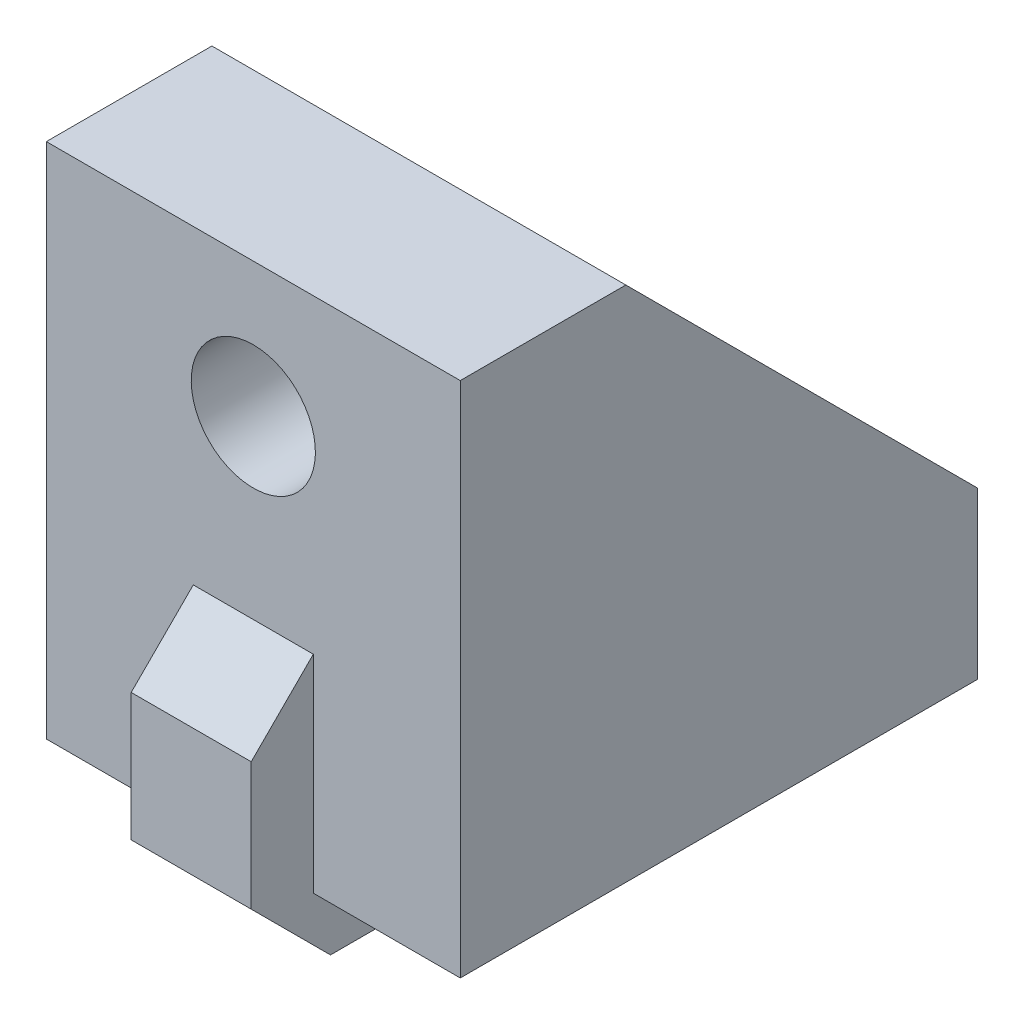
from build123d import *

# Parameters (mm, degrees)
BOSS_EXTRUDE1_DEPTH = 10
RIB18_REACH         = 36.641
SKETCH15_WALL_W     = 95.323662864
SKETCH15_WALL_H     = 4.5
RIB38_REACH         = 36.641
SKETCH17_WALL_W     = 95.323662864
SKETCH17_WALL_H     = 4.5
BOSS_EXTRUDE2_DEPTH = 2.9
SKETCH36_R          = 5.25
CUT_EXTRUDE4_DEPTH  = 1
SKETCH37_R          = 3
CUT_EXTRUDE5_DEPTH  = 8
SKETCH33_R          = 5.25
CUT_EXTRUDE1_DEPTH  = 1
SKETCH38_R          = 3
CUT_EXTRUDE6_DEPTH  = 8


with BuildPart() as part:
    # Sketch2 → Boss-Extrude1 (new, symmetric)
    with BuildSketch(Plane(origin=(0, 0, 0), x_dir=(0, 0, -1), z_dir=(1, 0, 0))):
        Polygon((-20, 5), (-12, 5), (-12, -12), (5, -12), (5, -20), (-20, -20), align=None)
    extrude(amount=BOSS_EXTRUDE1_DEPTH, both=True)

    # Sketch15 wall → Rib18 (add, up to next)
    with BuildSketch(Plane(origin=(10, -3.5, 3.5), x_dir=(0, -0.707106781187, -0.707106781187), z_dir=(0, 0.707106781187, -0.707106781187)), mode=Mode.PRIVATE) as rib18_sk1:
        with Locations((0, 2.25)):
            Rectangle(SKETCH15_WALL_W, SKETCH15_WALL_H)
    rib18_tool1 = extrude(rib18_sk1.sketch, amount=-RIB18_REACH, mode=Mode.PRIVATE) - part.part
    add(rib18_tool1.solids().sort_by_distance((10, -3.5, 3.5))[0])

    # Sketch17 wall → Rib38 (add, up to next)
    with BuildSketch(Plane(origin=(-10, -3.5, 3.5), x_dir=(0, -0.707106781187, -0.707106781187), z_dir=(0, -0.707106781187, 0.707106781187)), mode=Mode.PRIVATE) as rib38_sk1:
        with Locations((0, 2.25)):
            Rectangle(SKETCH17_WALL_W, SKETCH17_WALL_H)
    rib38_tool1 = extrude(rib38_sk1.sketch, amount=RIB38_REACH, mode=Mode.PRIVATE) - part.part
    add(rib38_tool1.solids().sort_by_distance((-10, -3.5, 3.5))[0])

    # Sketch31 → Boss-Extrude2 (add, symmetric)
    with BuildSketch(Plane(origin=(0, 0, 0), x_dir=(0, 0, -1), z_dir=(1, 0, 0))):
        Polygon((-20, -10), (-20, -20), (-10, -20), (-13, -23), (-19.170777974, -23), (-23, -19.170777974), (-23, -13), align=None)
    extrude(amount=BOSS_EXTRUDE2_DEPTH, both=True)

    # Sketch36 → Cut-Extrude4 (cut)
    with BuildSketch(Plane(origin=(0, 0, 12), x_dir=(-1, 0, 0), z_dir=(0, 0, -1))):
        with Locations(Location((0, -1.5, 0), (0, 0, 90))):
            Circle(SKETCH36_R)
    extrude(amount=-CUT_EXTRUDE4_DEPTH, mode=Mode.SUBTRACT)

    # Sketch37 → Cut-Extrude5 (cut)
    with BuildSketch(Plane(origin=(0, 0, 13), x_dir=(-1, 0, 0), z_dir=(0, 0, -1))):
        with Locations(Location((0, -1.5, 0), (0, 0, 90))):
            Circle(SKETCH37_R)
    extrude(amount=-CUT_EXTRUDE5_DEPTH, mode=Mode.SUBTRACT)

    # Sketch33 → Cut-Extrude1 (cut)
    with BuildSketch(Plane(origin=(0, -12, 0), x_dir=(1, 0, 0), z_dir=(0, 1, 0))):
        with Locations(Location((0, -1.5, 0), (0, 0, 270))):
            Circle(SKETCH33_R)
    extrude(amount=-CUT_EXTRUDE1_DEPTH, mode=Mode.SUBTRACT)

    # Sketch38 → Cut-Extrude6 (cut)
    with BuildSketch(Plane(origin=(0, -13, 0), x_dir=(1, 0, 0), z_dir=(0, 1, 0))):
        with Locations(Location((0, -1.5, 0), (0, 0, 270))):
            Circle(SKETCH38_R)
    extrude(amount=-CUT_EXTRUDE6_DEPTH, mode=Mode.SUBTRACT)


solid = part.part
